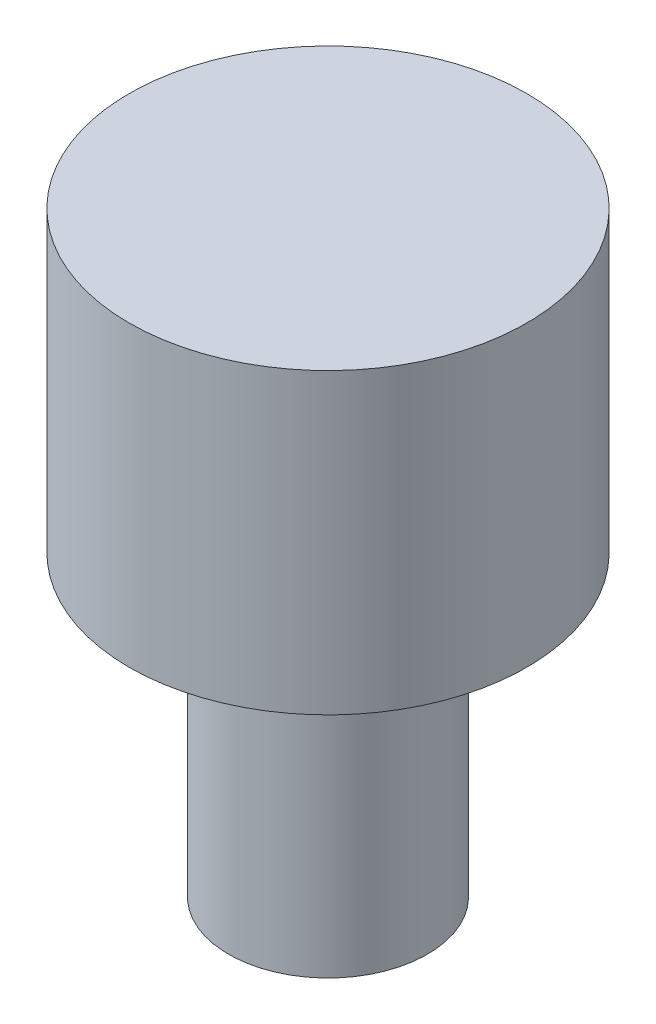
from build123d import *

# Parameters (mm, degrees)
IZIM2_R                     = 20
Y_KSEKLIK_EKSTR_ZYON1_DEPTH = 30
IZIM3_R                     = 10
Y_KSEKLIK_EKSTR_ZYON2_DEPTH = 30


with BuildPart() as part:
    # Çizim2 → Yükseklik-Ekstrüzyon1 (new body)
    with BuildSketch(Plane(origin=(0, 0, 0), x_dir=(1, 0, 0), z_dir=(0, 1, 0))):
        with Locations(Location((0, 0, 0), (0, 0, 270))):
            Circle(IZIM2_R)
    extrude(amount=-Y_KSEKLIK_EKSTR_ZYON1_DEPTH)

    # Çizim3 → Yükseklik-Ekstrüzyon2 (add)
    with BuildSketch(Plane.XZ.offset(30)):
        with Locations(Location((0, 0, 0), (0, 0, 270))):
            Circle(IZIM3_R)
    extrude(amount=Y_KSEKLIK_EKSTR_ZYON2_DEPTH)


solid = part.part
